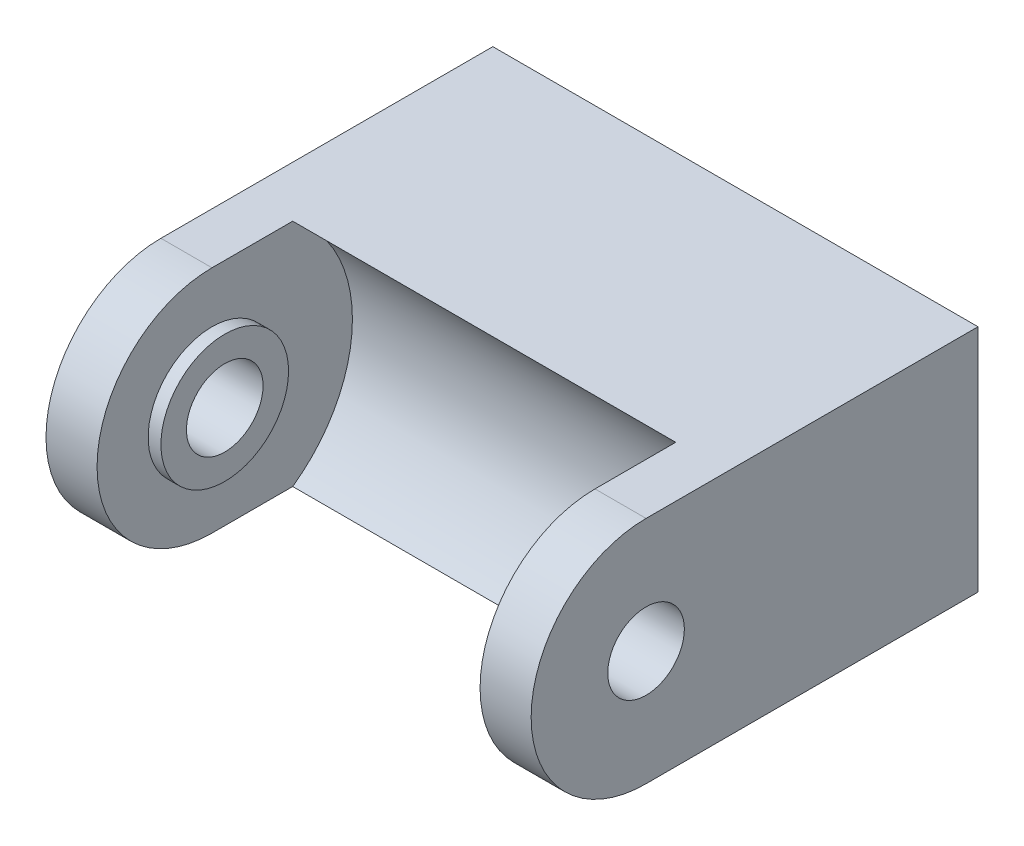
from build123d import *
from build123d.topology import SkipClean

# Parameters (mm, degrees)
EXTRUDE_1_DEPTH          = 9.5
EXTRUDE_1_DEPTH_BACK     = 9.5
CUT_EXTRUDE_1_DEPTH      = 7
CUT_EXTRUDE_1_DEPTH_BACK = 7
SKETCH_2_R               = 5.5
CUT_EXTRUDE_2_DEPTH      = 17.718253497
CUT_EXTRUDE_2_DEPTH_BACK = 17.718253497
SKETCH_3_R               = 1.5
CUT_EXTRUDE_3_DEPTH      = 7.5
CUT_EXTRUDE_3_DEPTH_BACK = 7.5
SKETCH_4_R               = 5.5
SKETCH_4_R_2             = 2.5
SKETCH_5_R               = 1.75
CUT_EXTRUDE_4_DEPTH      = 2


with BuildPart() as part:
    # Эскиз1 → Бобышка-Вытянуть1 (new, two sides: drawn at the far end of the back side and taken through both)
    with BuildSketch(Plane(origin=(0, 0, 0), x_dir=(0, 0, -1), z_dir=(1, 0, 0)).offset(-EXTRUDE_1_DEPTH_BACK)):
        with BuildLine():
            Line((13, 4.5), (0, 4.5))
            ThreePointArc((0, 4.5), (-4.5, 0), (0, -4.5))
            Line((0, -4.5), (13, -4.5))
            Line((13, -4.5), (13, 4.5))
        make_face()
    extrude(amount=EXTRUDE_1_DEPTH + EXTRUDE_1_DEPTH_BACK)

    # Эскиз2 → Вырез-Вытянуть1 (cut, two sides: drawn at the far end of the back side and taken through both)
    with BuildSketch(Plane(origin=(0, 0, 0), x_dir=(0, 0, -1), z_dir=(1, 0, 0)).offset(-CUT_EXTRUDE_1_DEPTH_BACK)):
        Circle(SKETCH_2_R)
    extrude(amount=CUT_EXTRUDE_1_DEPTH + CUT_EXTRUDE_1_DEPTH_BACK, mode=Mode.SUBTRACT)

    # Эскиз3 → Вырез-Вытянуть2 (cut, two sides: drawn at the far end of the back side and taken through both)
    with BuildSketch(Plane(origin=(0, 0, 0), x_dir=(0, 0, -1), z_dir=(1, 0, 0)).offset(-CUT_EXTRUDE_2_DEPTH_BACK)):
        Circle(SKETCH_3_R)
    extrude(amount=CUT_EXTRUDE_2_DEPTH + CUT_EXTRUDE_2_DEPTH_BACK, mode=Mode.SUBTRACT)

    # Эскиз4 → Вырез-Вытянуть3 (cut, two sides: drawn at the far end of the back side and taken through both)
    with SkipClean():  # the faces are left unmerged after this step: merging them gives an invalid solid
        with BuildSketch(Plane(origin=(0, 0, 0), x_dir=(0, 0, -1), z_dir=(1, 0, 0)).offset(-CUT_EXTRUDE_3_DEPTH_BACK)):
            Circle(SKETCH_4_R)
            Circle(SKETCH_4_R_2, mode=Mode.SUBTRACT)
        extrude(amount=CUT_EXTRUDE_3_DEPTH + CUT_EXTRUDE_3_DEPTH_BACK, mode=Mode.SUBTRACT)
    add(part.part.scale(1), mode=Mode.REPLACE)  # the faces are merged on a copy

    # Эскиз5 → Вырез-Вытянуть4 (cut)
    with BuildSketch(Plane(origin=(0, 0, -13), x_dir=(-1, 0, 0), z_dir=(0, 0, -1))):
        Circle(SKETCH_5_R)
    extrude(amount=-CUT_EXTRUDE_4_DEPTH, mode=Mode.SUBTRACT)


solid = part.part
